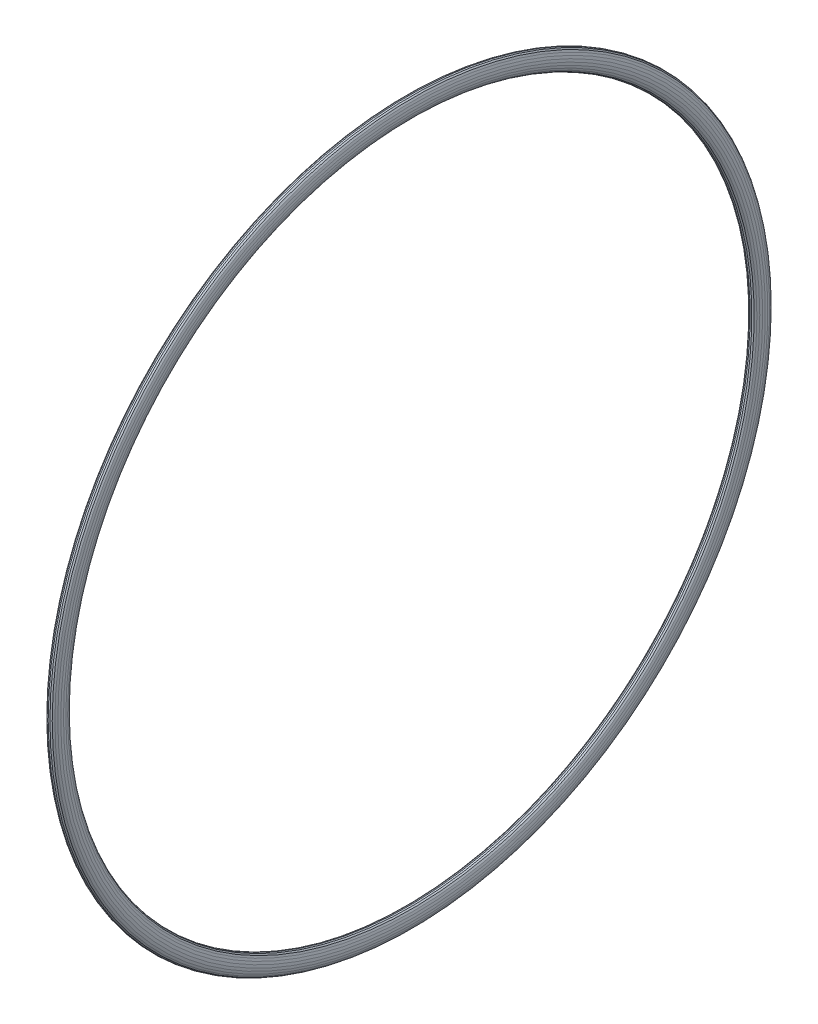
from build123d import *


with BuildPart() as part:
    # O_Ring_Inner Sketch → O_Ring_Inner (revolve)
    with BuildSketch(Plane.XY):
        Polygon((-1.955, 62.78), (-1.921777681, 63.235548065), (-1.824374769, 63.660051282), (-1.669429112, 64.024580459), (-1.4675, 64.304293534), (-1.232348569, 64.480128524), (-0.98, 64.540102564), (-0.727651431, 64.480128524), (-0.4925, 64.304293534), (-0.290570888, 64.024580459), (-0.135625231, 63.660051282), (-0.038222319, 63.235548065), (-0.005, 62.78), (-0.038222319, 62.324451935), (-0.135625231, 61.899948718), (-0.290570888, 61.535419541), (-0.4925, 61.255706466), (-0.727651431, 61.079871476), (-0.98, 61.019897436), (-1.232348569, 61.079871476), (-1.4675, 61.255706466), (-1.669429112, 61.535419541), (-1.824374769, 61.899948718), (-1.921777681, 62.324451935), align=None)
    revolve(axis=Axis((-1000, 0, 0), (1, 0, 0)))


solid = part.part
